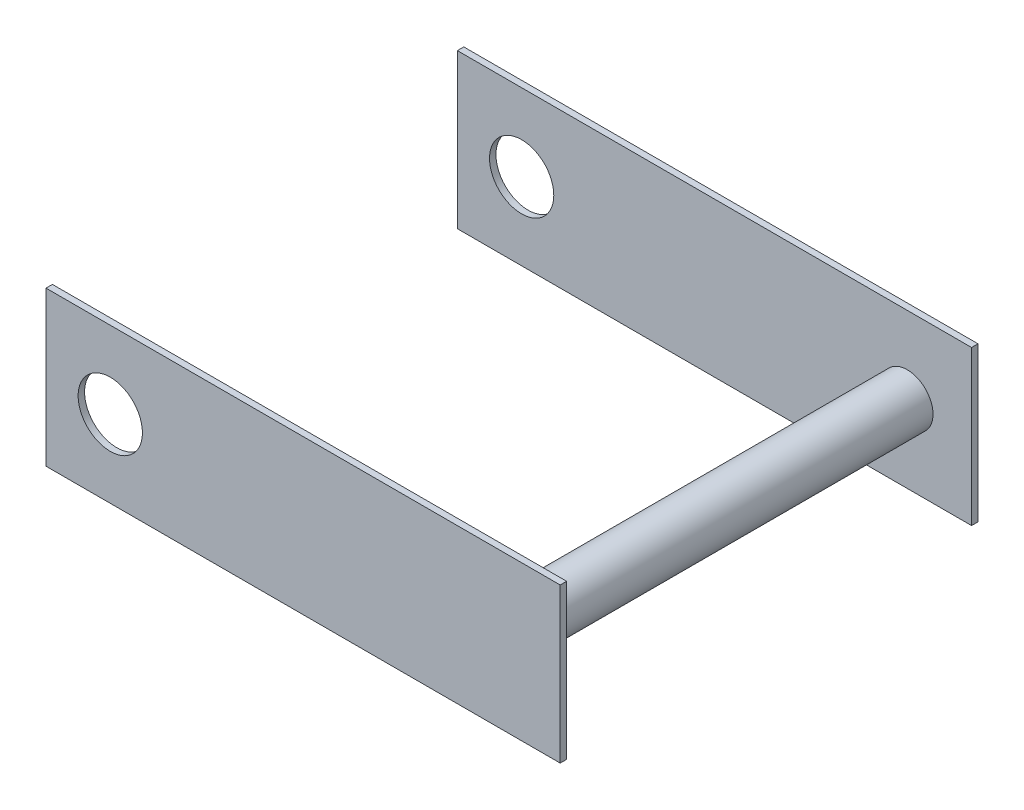
from build123d import *

# Parameters (mm, degrees)
BOSS_EXTRUDE1_DEPTH      = 76.2
BOSS_EXTRUDE1_DEPTH_BACK = 88.9
SKETCH4_R                = 10.16
SKETCH7_W                = 203.2
SKETCH7_H                = 60.96
BOSS_EXTRUDE2_DEPTH      = 2.54
SKETCH8_W                = 203.2
SKETCH8_H                = 60.96
BOSS_EXTRUDE3_DEPTH      = 2.54
SKETCH9_R                = 12.7
CUT_EXTRUDE1_DEPTH       = 227.74390929


with BuildPart() as part:
    # Sketch4 → Boss-Extrude1 (new, two sides: drawn at the far end of the back side and taken through both)
    with BuildSketch(Plane.XY.offset(-BOSS_EXTRUDE1_DEPTH_BACK)):
        with Locations((25.4, 0)):
            Circle(SKETCH4_R)
    extrude(amount=BOSS_EXTRUDE1_DEPTH + BOSS_EXTRUDE1_DEPTH_BACK)

    # Sketch7 → Boss-Extrude2 (add)
    with BuildSketch(Plane(origin=(0, 0, -88.9), x_dir=(-1, 0, 0), z_dir=(0, 0, -1))):
        with Locations((50.8, 0)):
            Rectangle(SKETCH7_W, SKETCH7_H)
    extrude(amount=-BOSS_EXTRUDE2_DEPTH)

    # Sketch8 → Boss-Extrude3 (add)
    with BuildSketch(Plane.XY.offset(76.2)):
        with Locations((-50.8, 0)):
            Rectangle(SKETCH8_W, SKETCH8_H)
    extrude(amount=-BOSS_EXTRUDE3_DEPTH)

    # Sketch9 → Cut-Extrude1 (cut, through all)
    with BuildSketch(Plane.XY.offset(76.2)):
        with Locations((-127, 0)):
            Circle(SKETCH9_R)
    extrude(amount=-CUT_EXTRUDE1_DEPTH, mode=Mode.SUBTRACT)


solid = part.part
